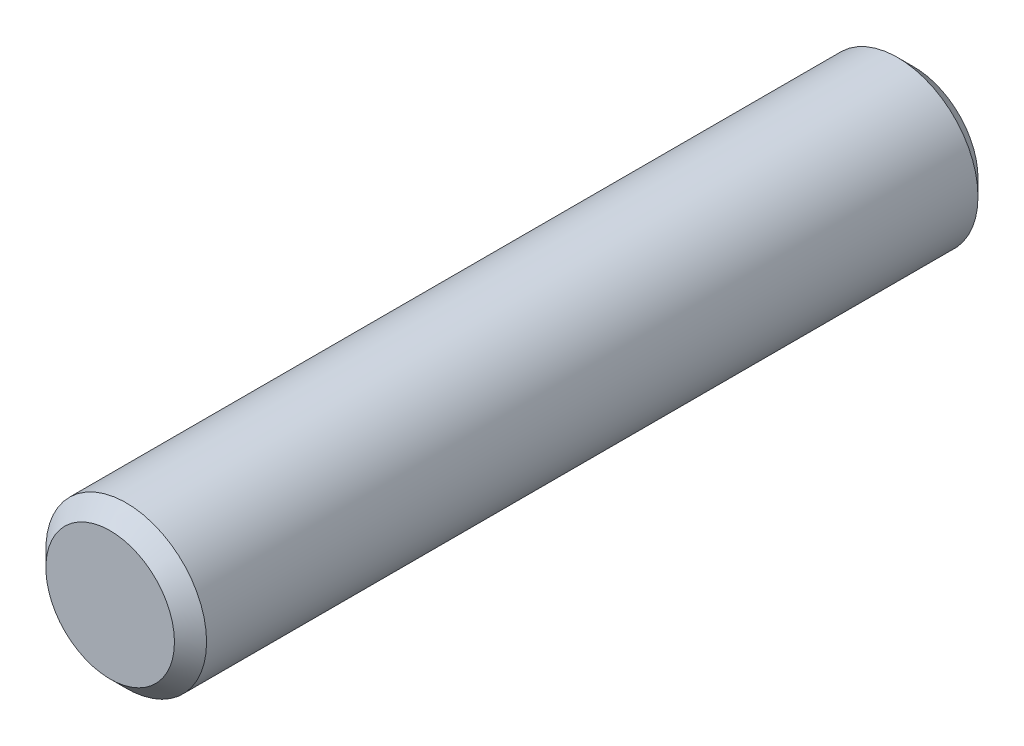
from build123d import *

# Parameters (mm, degrees)
SKETCH1_R      = 1.27
EXTRUDE1_DEPTH = 6.35
CHAMFER1_SIZE  = 0.254


with BuildPart() as part:
    # Sketch1 → Extrude1 (new, symmetric)
    with BuildSketch(Plane.XY):
        Circle(SKETCH1_R)
    extrude(amount=EXTRUDE1_DEPTH, both=True)

    # Chamfer1
    chamfer1_edges = [part.edges().sort_by_distance(p)[0] for p in [
        (-1.27, 0, -6.35),
        (-1.27, 0, 6.35),
    ]]
    chamfer(chamfer1_edges, length=CHAMFER1_SIZE)


solid = part.part
